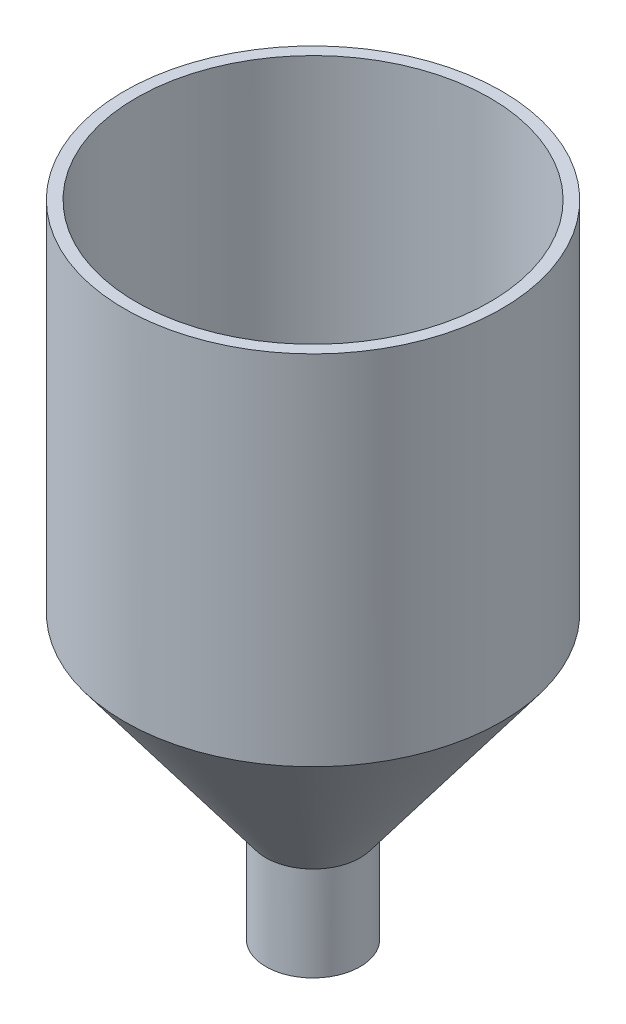
from build123d import *


with BuildPart() as part:
    # Esquisse1 → Révolution1 (revolve)
    with BuildSketch(Plane.XY, mode=Mode.PRIVATE) as r_volution1_sk:
        Polygon((-3, 0), (-3, 8.333333333), (-15, 24.333333333), (-15, 54.333333333), (-16, 54.333333333), (-16, 24), (-4, 8), (-4, 0), align=None)
    revolve(r_volution1_sk.sketch.rotate(Axis((0, 0, 0), (0, 1, 0)), 270), axis=Axis((0, 0, 0), (0, 1, 0)))


solid = part.part
